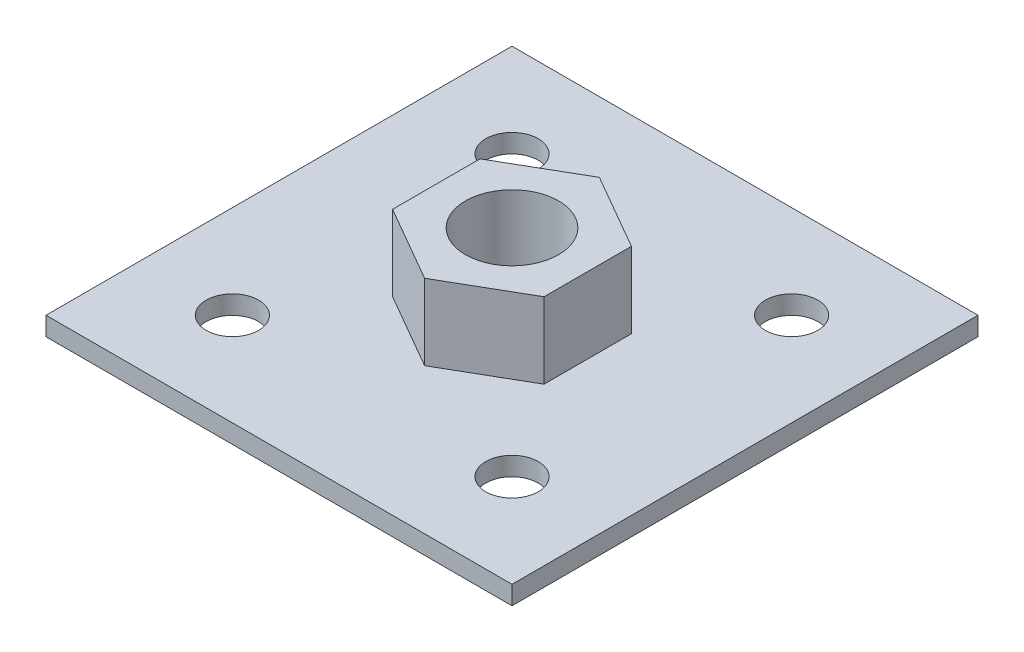
from build123d import *

# Parameters (mm, degrees)
SKETCH_1_W          = 40
SKETCH_1_H          = 40
SKETCH_1_R          = 2.25
EXTRUDE_1_DEPTH     = 1.6
EXTRUDE_2_DEPTH     = 6.5
SKETCH_3_R          = 4
CUT_EXTRUDE_1_DEPTH = 30.421250823


with BuildPart() as part:
    # ｽｹｯﾁ1 → ﾎﾞｽ - 押し出し1 (new body)
    with BuildSketch(Plane(origin=(0, 0, 0), x_dir=(1, 0, 0), z_dir=(0, 1, 0))):
        Rectangle(SKETCH_1_W, SKETCH_1_H)
        with Locations(Location((-12, 12, 0), (0, 0, 270))):
            Circle(SKETCH_1_R, mode=Mode.SUBTRACT)
        with Locations(Location((12, 12, 0), (0, 0, 270))):
            Circle(SKETCH_1_R, mode=Mode.SUBTRACT)
        with Locations(Location((-12, -12, 0), (0, 0, 270))):
            Circle(SKETCH_1_R, mode=Mode.SUBTRACT)
        with Locations(Location((12, -12, 0), (0, 0, 270))):
            Circle(SKETCH_1_R, mode=Mode.SUBTRACT)
    extrude(amount=EXTRUDE_1_DEPTH)

    # ｽｹｯﾁ2 → ﾎﾞｽ - 押し出し2 (add)
    with BuildSketch(Plane(origin=(0, 1.6, 0), x_dir=(1, 0, 0), z_dir=(0, 1, 0))):
        Polygon((0, 7.5), (6.5, 3.751666445), (6.5, -3.751666445), (0, -7.5), (-6.5, -3.751666445), (-6.5, 3.751666445), align=None)
    extrude(amount=EXTRUDE_2_DEPTH)

    # ｽｹｯﾁ3 → ｶｯﾄ - 押し出し1 (cut, through all)
    with BuildSketch(Plane(origin=(0, 8.1, 0), x_dir=(1, 0, 0), z_dir=(0, 1, 0))):
        with Locations(Location((0, 0, 0), (0, 0, 270))):
            Circle(SKETCH_3_R)
    extrude(amount=-CUT_EXTRUDE_1_DEPTH, mode=Mode.SUBTRACT)


solid = part.part
